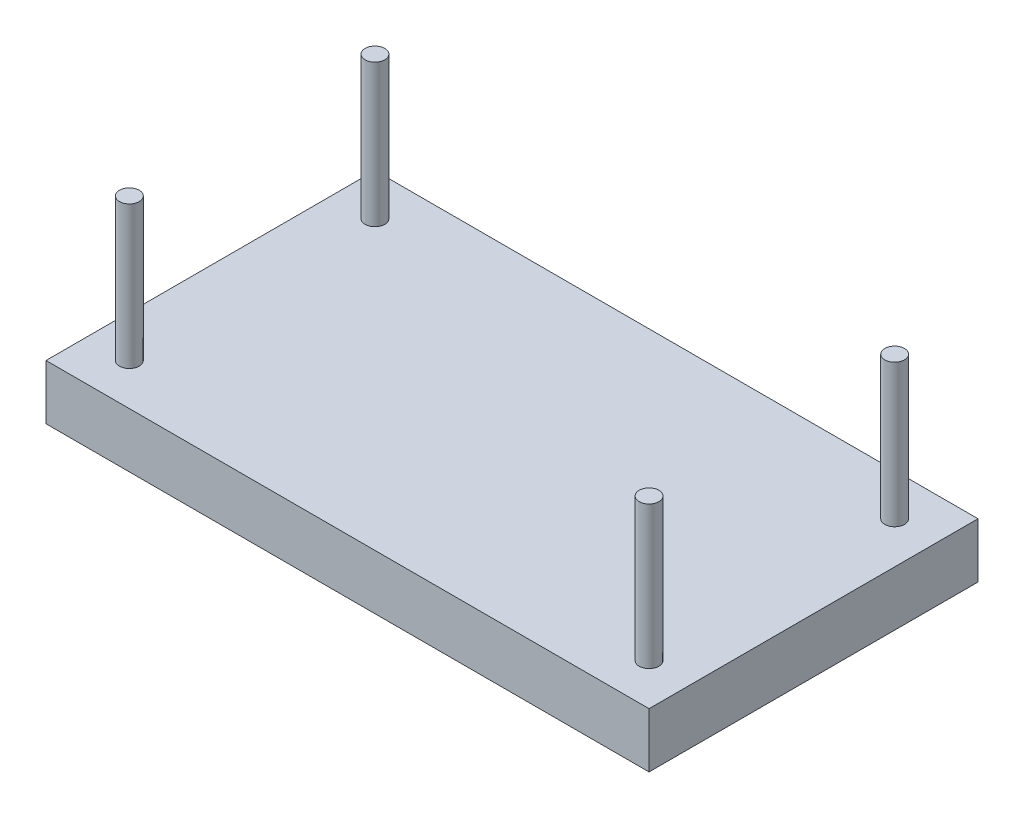
from build123d import *

# Parameters (mm, degrees)
SKETCH1_W           = 55
SKETCH1_H           = 30
BOSS_EXTRUDE1_DEPTH = 5
SKETCH2_R           = 0.9
BOSS_EXTRUDE2_DEPTH = 13


with BuildPart() as part:
    # Sketch1 → Boss-Extrude1 (new body)
    with BuildSketch(Plane(origin=(0, 0, 0), x_dir=(1, 0, 0), z_dir=(0, 1, 0))):
        with Locations((25.5, 13)):
            Rectangle(SKETCH1_W, SKETCH1_H)
    extrude(amount=BOSS_EXTRUDE1_DEPTH)

    # Sketch2 → Boss-Extrude2 (add)
    with BuildSketch(Plane(origin=(0, 5, 0), x_dir=(1, 0, 0), z_dir=(0, 1, 0))):
        with Locations(Location((1.8, 24.2, 0), (0, 0, 90))):
            Circle(SKETCH2_R)
        with Locations(Location((49.2, 24.2, 0), (0, 0, 90))):
            Circle(SKETCH2_R)
        with Locations(Location((49.2, 1.8, 0), (0, 0, 90))):
            Circle(SKETCH2_R)
        with Locations(Location((1.8, 1.8, 0), (0, 0, 90))):
            Circle(SKETCH2_R)
    extrude(amount=BOSS_EXTRUDE2_DEPTH)


solid = part.part
